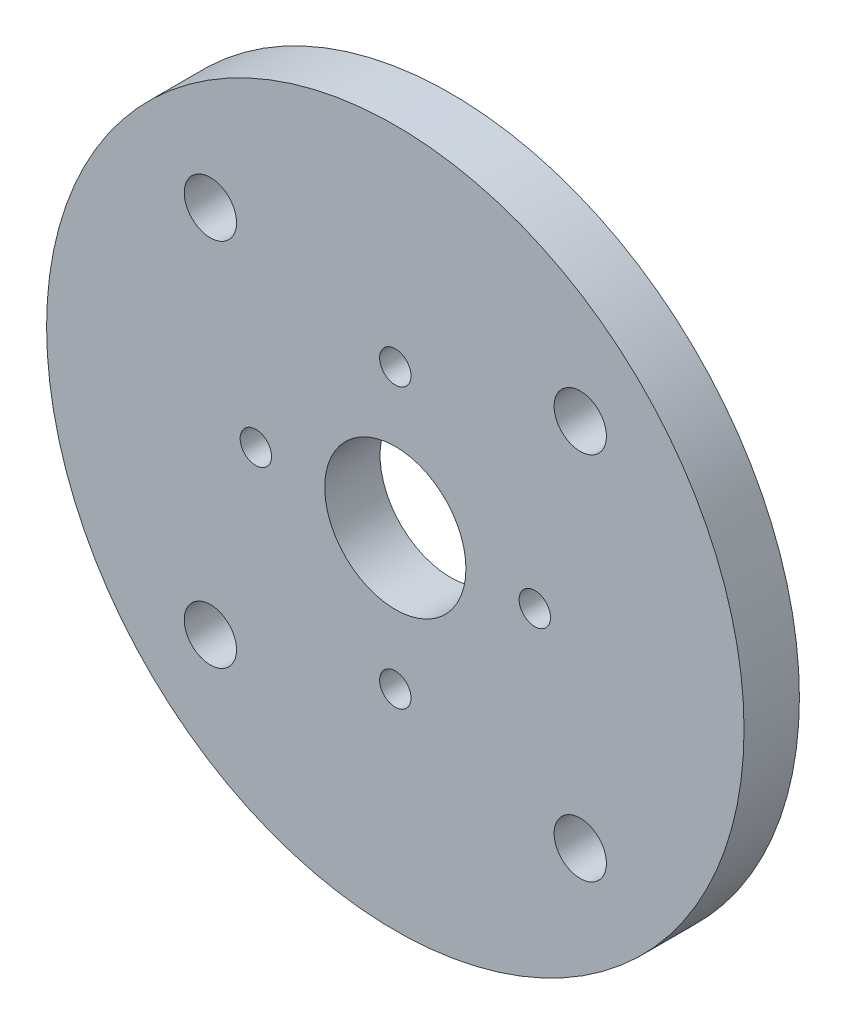
from build123d import *

# Parameters (mm, degrees)
ESQUISSE1_R                  = 20
BOSS_EXTRU_1_DEPTH           = 3.175
ESQUISSE2_R                  = 4.05
ESQUISSE2_R_2                = 0.9
ENL_V_MAT_EXTRU_1_DEPTH      = 29.461915343
ENL_V_MAT_EXTRU_2_DEPTH      = 29.461915343
ENL_V_MAT_EXTRU_2_DEPTH_BACK = 29.461915343
ESQUISSE3_R                  = 1.5


with BuildPart() as part:
    # Esquisse1 → Boss.-Extru.1 (new body)
    with BuildSketch(Plane.XY):
        Circle(ESQUISSE1_R)
    extrude(amount=BOSS_EXTRU_1_DEPTH)

    # Esquisse2 → Enlèv. mat.-Extru.1 (cut, through all)
    with BuildSketch(Plane.XY.offset(3.175)):
        Circle(ESQUISSE2_R)
        with Locations((0, 8)):
            Circle(ESQUISSE2_R_2)
        with Locations((8, 0)):
            Circle(ESQUISSE2_R_2)
        with Locations((0, -8)):
            Circle(ESQUISSE2_R_2)
        with Locations((-8, 0)):
            Circle(ESQUISSE2_R_2)
    extrude(amount=-ENL_V_MAT_EXTRU_1_DEPTH, mode=Mode.SUBTRACT)

    # Esquisse3 → Enlèv. mat.-Extru.2 (cut, two sides: drawn at the far end of the back side and taken through both)
    with BuildSketch(Plane.XY.offset(3.175).offset(-ENL_V_MAT_EXTRU_2_DEPTH_BACK)):
        with Locations((10.606601718, 10.606601718)):
            Circle(ESQUISSE3_R)
        with Locations((10.606601718, -10.606601718)):
            Circle(ESQUISSE3_R)
        with Locations((-10.606601718, -10.606601718)):
            Circle(ESQUISSE3_R)
        with Locations((-10.606601718, 10.606601718)):
            Circle(ESQUISSE3_R)
    extrude(amount=ENL_V_MAT_EXTRU_2_DEPTH + ENL_V_MAT_EXTRU_2_DEPTH_BACK, mode=Mode.SUBTRACT)


solid = part.part
